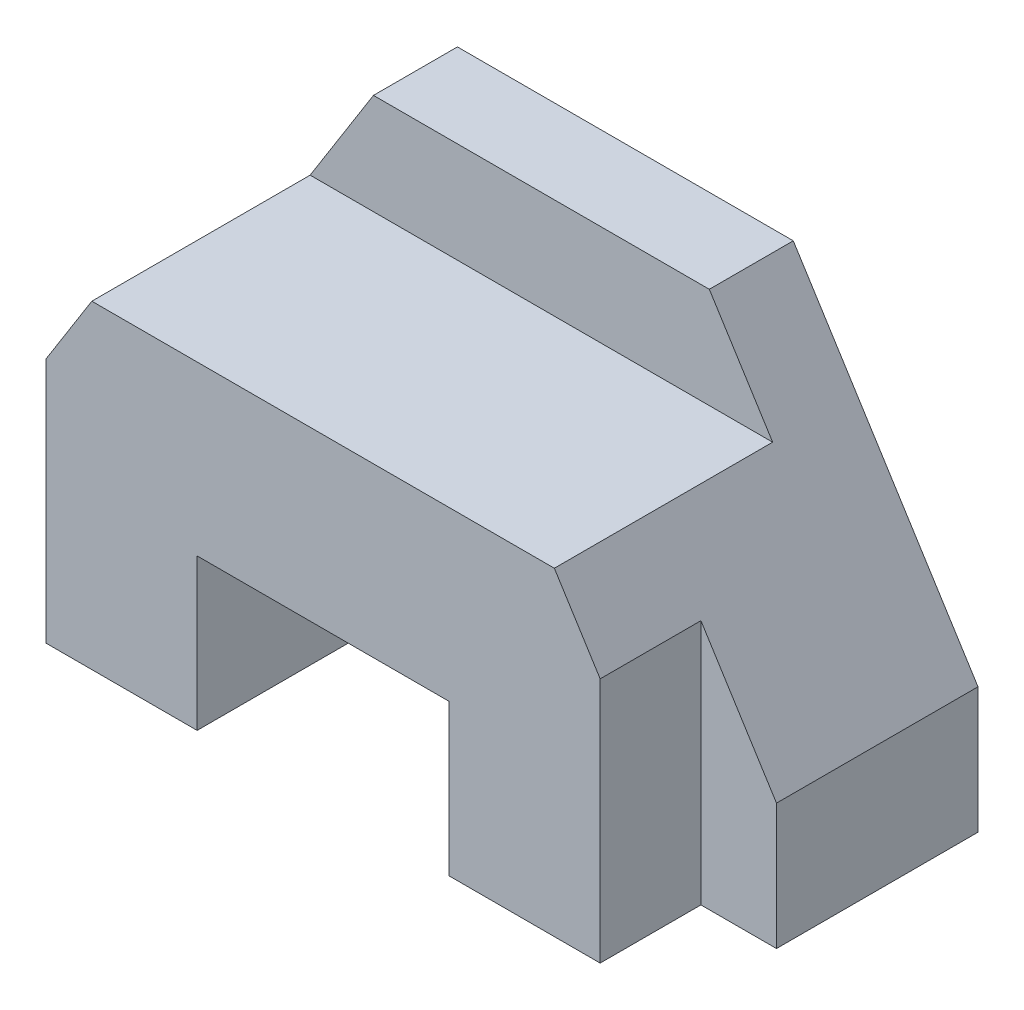
from build123d import *

# Parameters (mm, degrees)
SALIENTE_EXTRUIR1_DEPTH = 36
CORTAR_EXTRUIR1_DEPTH   = 26
CORTAR_EXTRUIR2_DEPTH   = 12
CROQUIS4_W              = 30
CROQUIS4_H              = 18
CORTAR_EXTRUIR3_DEPTH   = 66.459911396


with BuildPart() as part:
    # Croquis1 → Saliente-Extruir1 (new body)
    with BuildSketch(Plane.XY):
        Polygon((-42, -15), (42, -15), (42, 0), (20, 35), (-20, 35), (-42, 0), align=None)
    extrude(amount=SALIENTE_EXTRUIR1_DEPTH)

    # Croquis2 → Cortar-Extruir1 (cut)
    with BuildSketch(Plane.XY.offset(36)):
        Polygon((-20, 35), (-27.542857143, 23), (27.542857143, 23), (20, 35), align=None)
    extrude(amount=-CORTAR_EXTRUIR1_DEPTH, mode=Mode.SUBTRACT)

    # Croquis3 → Cortar-Extruir2 (cut)
    with BuildSketch(Plane.XY.offset(36)):
        Polygon((33, 14.318181818), (33, -15), (42, -15), (42, 0), align=None)
        Polygon((-33, -15), (-33, 14.318181818), (-42, 0), (-42, -15), align=None)
    extrude(amount=-CORTAR_EXTRUIR2_DEPTH, mode=Mode.SUBTRACT)

    # Croquis4 → Cortar-Extruir3 (cut, through all)
    with BuildSketch(Plane.XY.offset(36)):
        with Locations((0, -6)):
            Rectangle(CROQUIS4_W, CROQUIS4_H)
    extrude(amount=-CORTAR_EXTRUIR3_DEPTH, mode=Mode.SUBTRACT)


solid = part.part
